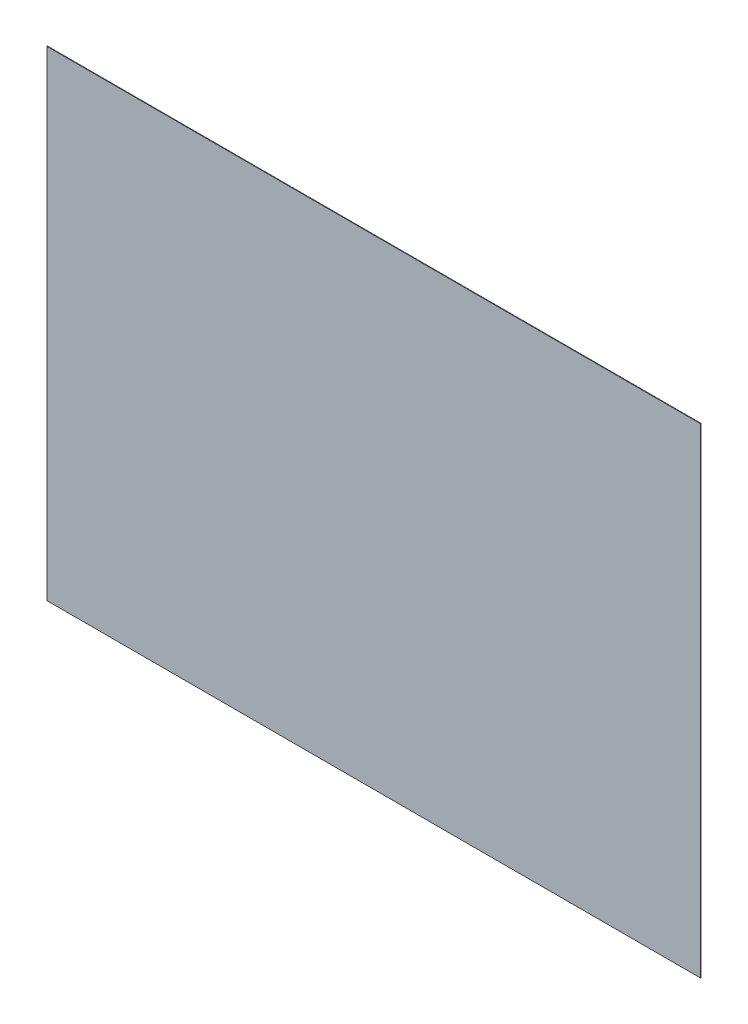
from build123d import *

# Parameters (mm, degrees)
ESQUISSE1_W        = 57.6
ESQUISSE1_H        = 42.3
BOSS_EXTRU_1_DEPTH = 0.05


with BuildPart() as part:
    # Esquisse1 → Boss.-Extru.1 (new body)
    with BuildSketch(Plane.XY):
        Rectangle(ESQUISSE1_W, ESQUISSE1_H)
    extrude(amount=BOSS_EXTRU_1_DEPTH)


solid = part.part
